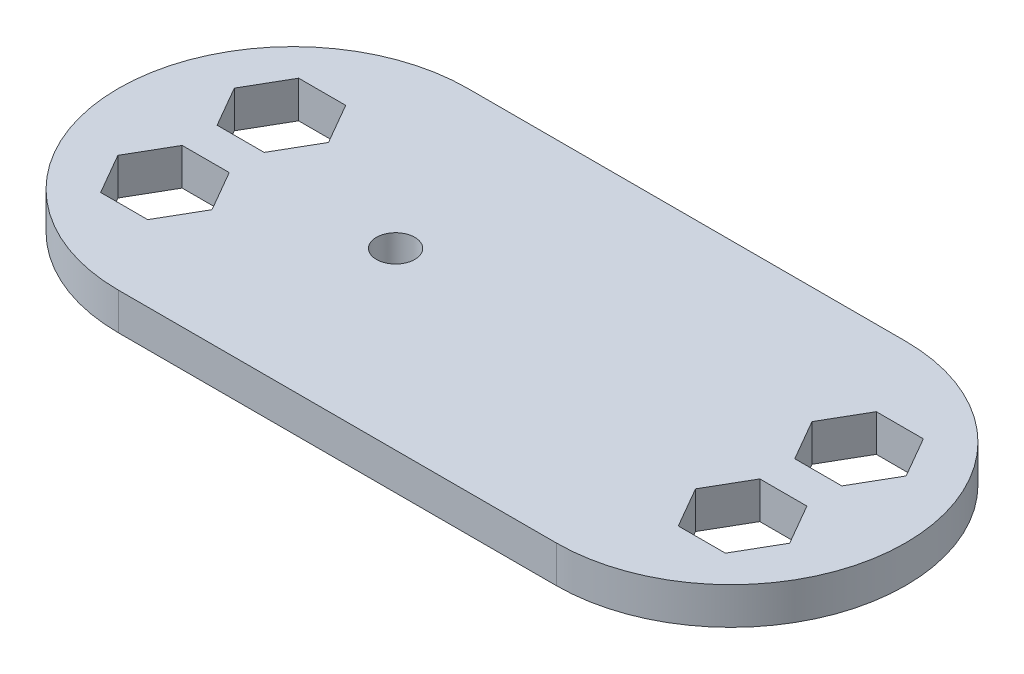
from build123d import *

# Parameters (mm, degrees)
BOSS_EXTRUDE1_DEPTH = 3.175
SKETCH3_R           = 1.65
CUT_EXTRUDE1_DEPTH  = 3.175


with BuildPart() as part:
    # Sketch2 → Boss-Extrude1 (new body)
    with BuildSketch(Plane(origin=(0, 0, 0), x_dir=(1, 0, 0), z_dir=(0, 1, 0))):
        with BuildLine():
            Line((-145.521414695, 0.997059393), (-107.921414695, 0.997059393))
            ThreePointArc((-107.921414695, 0.997059393), (-92.921414695, -14.002940607), (-107.921414695, -29.002940607))
            Line((-107.921414695, -29.002940607), (-145.521414695, -29.002940607))
            ThreePointArc((-145.521414695, -29.002940607), (-160.521414695, -14.002940607), (-145.521414695, 0.997059393))
        make_face()
        Polygon((-149.500688753, -12.502940607), (-147.479962811, -9.002940607), (-149.500688753, -5.502940607), (-153.542140637, -5.502940607), (-155.562866579, -9.002940607), (-153.542140637, -12.502940607), align=None, mode=Mode.SUBTRACT)
        Polygon((-153.542140637, -15.502940607), (-149.500688753, -15.502940607), (-147.479962811, -19.002940607), (-149.500688753, -22.502940607), (-153.542140637, -22.502940607), (-155.562866579, -19.002940607), align=None, mode=Mode.SUBTRACT)
        Polygon((-103.942140637, -15.502940607), (-105.962866579, -19.002940607), (-103.942140637, -22.502940607), (-99.900688753, -22.502940607), (-97.879962811, -19.002940607), (-99.900688753, -15.502940607), align=None, mode=Mode.SUBTRACT)
        Polygon((-99.900688753, -12.502940607), (-103.942140637, -12.502940607), (-105.962866579, -9.002940607), (-103.942140637, -5.502940607), (-99.900688753, -5.502940607), (-97.879962811, -9.002940607), align=None, mode=Mode.SUBTRACT)
    extrude(amount=BOSS_EXTRUDE1_DEPTH)

    # Sketch3 → Cut-Extrude1 (cut)
    with BuildSketch(Plane.XZ):
        with Locations(Location((-136.722782871, 13.998131439, 0), (0, 0, 270))):
            Circle(SKETCH3_R)
    extrude(amount=-CUT_EXTRUDE1_DEPTH, mode=Mode.SUBTRACT)


solid = part.part
